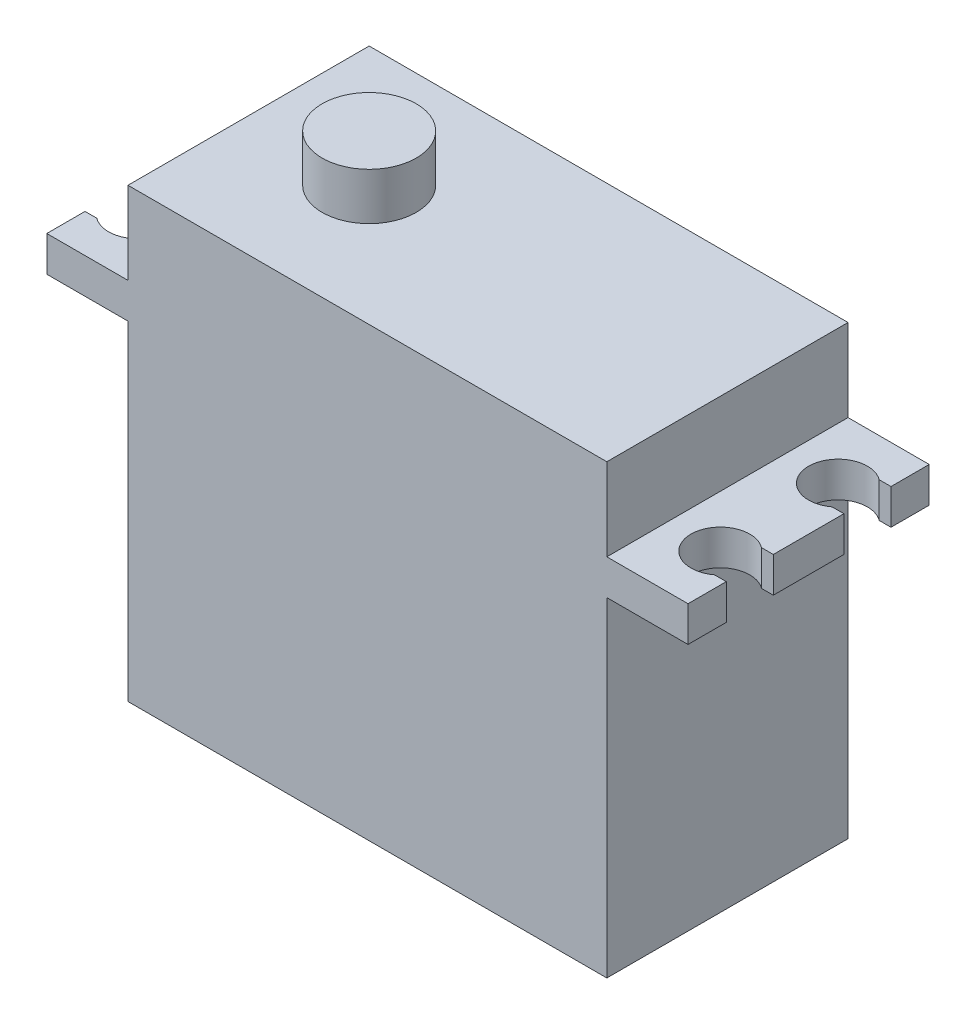
from build123d import *

# Parameters (mm, degrees)
SKETCH1_W            = 40.7
SKETCH1_H            = 20.5
BOSS_EXTRUDE1_DEPTH  = 38
SKETCH2_R            = 4
BOSS_EXTRUDE2_DEPTH  = 4
SKETCH3_W            = 54.5
SKETCH3_H            = 20.5
BOSS_EXTRUDE3_DEPTH  = 3
CUT_EXTRUDE1_DEPTH   = 59.90679078
MIRROR2_COPY_1_DEPTH = 59.90679078


with BuildPart() as part:
    # Sketch1 → Boss-Extrude1 (new body)
    with BuildSketch(Plane(origin=(0, 0, 0), x_dir=(1, 0, 0), z_dir=(0, 1, 0))):
        with Locations((20.35, 10.25)):
            Rectangle(SKETCH1_W, SKETCH1_H)
    extrude(amount=BOSS_EXTRUDE1_DEPTH)

    # Sketch2 → Boss-Extrude2 (add)
    with BuildSketch(Plane(origin=(0, 38, 0), x_dir=(1, 0, 0), z_dir=(0, 1, 0))):
        with Locations(Location((10.25, 10.25, 0), (0, 0, 90))):
            Circle(SKETCH2_R)
    extrude(amount=BOSS_EXTRUDE2_DEPTH)

    # Sketch3 → Boss-Extrude3 (add)
    with BuildSketch(Plane(origin=(0, 28, 0), x_dir=(1, 0, 0), z_dir=(0, 1, 0))):
        with Locations((20.35, 10.25)):
            Rectangle(SKETCH3_W, SKETCH3_H)
    extrude(amount=BOSS_EXTRUDE3_DEPTH)

    # Sketch4 → Cut-Extrude1 (cut, through all)
    with BuildSketch(Plane(origin=(0, 28, 0), x_dir=(1, 0, 0), z_dir=(0, 1, 0))):
        with BuildLine():
            Line((-5.9, 17.25), (-6.9, 17.25))
            Line((-6.9, 17.25), (-6.9, 13.25))
            Line((-6.9, 13.25), (-5.9, 13.25))
            ThreePointArc((-5.9, 13.25), (-1.9, 15.25), (-5.9, 17.25))
        make_face()
    cut_extrude1 = extrude(amount=CUT_EXTRUDE1_DEPTH, mode=Mode.SUBTRACT)

    # Mirror1: Cut-Extrude1 across plane
    add(cut_extrude1.mirror(Plane(origin=(0, 0, -10.25), x_dir=(1, 0, 0), z_dir=(0, 0, -1))), mode=Mode.SUBTRACT)

    # Mirror2: Cut-Extrude1 across plane
    add(cut_extrude1.mirror(Plane(origin=(20.35, 0, 0), x_dir=(0, 0, 1), z_dir=(1, 0, 0))), mode=Mode.SUBTRACT)

    # Mirror2 copy 1 sketch → Mirror2 copy 1 (cut, through all)
    with BuildSketch(Plane(origin=(40.7, 28, -20.5), x_dir=(-1, 0, 0), z_dir=(0, 1, 0))):
        with BuildLine():
            Line((-5.9, 17.25), (-6.9, 17.25))
            Line((-6.9, 17.25), (-6.9, 13.25))
            Line((-6.9, 13.25), (-5.9, 13.25))
            ThreePointArc((-5.9, 13.25), (-1.9, 15.25), (-5.9, 17.25))
        make_face()
    extrude(amount=MIRROR2_COPY_1_DEPTH, mode=Mode.SUBTRACT)


solid = part.part
